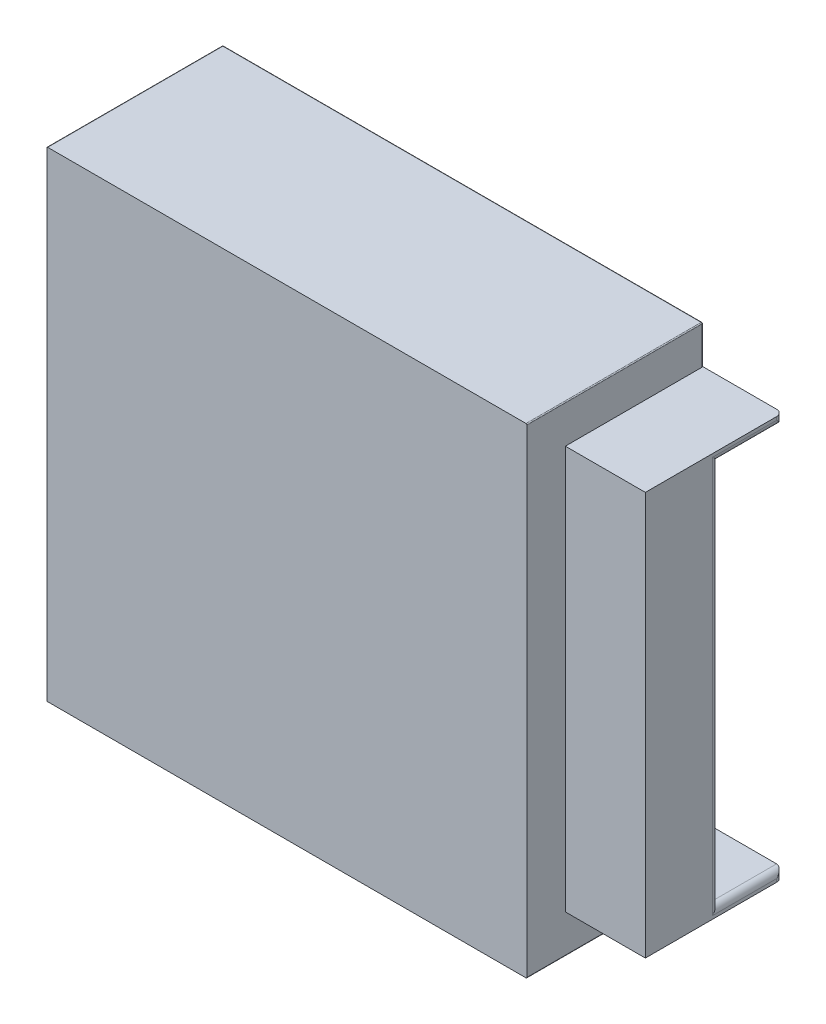
from build123d import *

# Parameters (mm, degrees)
SKETCH_1_W           = 150
SKETCH_1_H           = 150
EXTRUDE_2_DEPTH      = 55
CUT_EXTRUDE_1_DEPTH  = 52
SKETCH_3_W           = 20
SKETCH_3_H           = 25.2
CUT_EXTRUDE_2_DEPTH  = 52
SKETCH_4_W           = 31.2
SKETCH_4_H           = 23.663491794
CUT_EXTRUDE_3_DEPTH  = 52
SKETCH_5_W           = 46
SKETCH_5_H           = 120
SKETCH_5_W_2         = 29
CUT_EXTRUDE_4_DEPTH  = 40
SKETCH_6_W           = 3
SKETCH_6_H           = 120
EXTRUDE_4_DEPTH      = 25
SKETCH_7_W           = 3
SKETCH_7_H           = 120
EXTRUDE_5_DEPTH      = 20
CUT_EXTRUDE_6_DEPTH  = 30
FILLET_1_R           = 7
SKETCH_10_W          = 80
SKETCH_10_H          = 50
CUT_EXTRUDE_7_DEPTH  = 30
SKETCH_11_W          = 11.4
SKETCH_11_H          = 20
CUT_EXTRUDE_8_DEPTH  = 30
FILLET_2_R           = 5
FILLET_3_R           = 2
SKETCH_12_W          = 12.6
SKETCH_12_H          = 20
CUT_EXTRUDE_9_DEPTH  = 20
FILLET_4_R           = 2
SKETCH_13_R          = 0.75
CUT_EXTRUDE_10_DEPTH = 5
FILLET_5_R           = 2
FILLET_6_R           = 1
FILLET_8_R           = 0.3


with BuildPart() as part:
    # 草图1 → 凸台-拉伸2 (new body)
    with BuildSketch(Plane.XY):
        with Locations((75, -75)):
            Rectangle(SKETCH_1_W, SKETCH_1_H)
    extrude(amount=EXTRUDE_2_DEPTH)

    # 草图2 → 切除-拉伸1 (cut)
    with BuildSketch(Plane(origin=(0, 0, 0), x_dir=(-1, 0, 0), z_dir=(0, 0, -1))):
        Polygon((-57.4, -53), (-92.6, -53), (-97, -57.4), (-97, -92.6), (-92.6, -97), (-57.4, -97), (-53, -92.6), (-53, -57.4), align=None)
    extrude(amount=-CUT_EXTRUDE_1_DEPTH, mode=Mode.SUBTRACT)

    # 草图3 → 切除-拉伸2 (cut)
    with BuildSketch(Plane(origin=(0, 0, 0), x_dir=(-1, 0, 0), z_dir=(0, 0, -1))):
        with Locations((-43, -75)):
            Rectangle(SKETCH_3_W, SKETCH_3_H)
    extrude(amount=-CUT_EXTRUDE_2_DEPTH, mode=Mode.SUBTRACT)

    # 草图4 → 切除-拉伸3 (cut)
    with BuildSketch(Plane(origin=(0, 0, 0), x_dir=(-1, 0, 0), z_dir=(0, 0, -1))):
        with Locations((-75, -41.168254103)):
            Rectangle(SKETCH_4_W, SKETCH_4_H)
    extrude(amount=-CUT_EXTRUDE_3_DEPTH, mode=Mode.SUBTRACT)

    # 草图5 → 切除-拉伸4 (cut)
    with BuildSketch(Plane(origin=(0, 0, 0), x_dir=(-1, 0, 0), z_dir=(0, 0, -1))):
        with Locations((-127, -75)):
            Rectangle(SKETCH_5_W, SKETCH_5_H)
        with Locations((-164.5, -75)):
            Rectangle(SKETCH_5_W_2, SKETCH_5_H)
    extrude(amount=-CUT_EXTRUDE_4_DEPTH, mode=Mode.SUBTRACT)

    # 草图6 → 凸台-拉伸4 (add)
    with BuildSketch(Plane(origin=(150, 0, 0), x_dir=(0, 0, -1), z_dir=(1, 0, 0))):
        Polygon((-43, -15), (-40, -15), (0, -15), (0, -12), (-43, -12), align=None)
        with Locations((-41.5, -75)):
            Rectangle(SKETCH_6_W, SKETCH_6_H)
        Polygon((0, -135), (-40, -135), (-43, -135), (-43, -138), (0, -138), align=None)
    extrude(amount=EXTRUDE_4_DEPTH)

    # 草图7 → 凸台-拉伸5 (add)
    with BuildSketch(Plane(origin=(0, 0, 40), x_dir=(-1, 0, 0), z_dir=(0, 0, -1))):
        with Locations((-173.5, -75)):
            Rectangle(SKETCH_7_W, SKETCH_7_H)
    extrude(amount=EXTRUDE_5_DEPTH)

    # 草图8 → 切除-拉伸6 (cut)
    with BuildSketch(Plane(origin=(0, 0, 0), x_dir=(-1, 0, 0), z_dir=(0, 0, -1))):
        Polygon((-69, -15), (-104, -15), (-104, -29.336508206), (-90.6, -29.336508206), (-69, -29.336508206), align=None)
    extrude(amount=-CUT_EXTRUDE_6_DEPTH, mode=Mode.SUBTRACT)

    # 圆角1
    fillet_1_edges = [part.edges().sort_by_distance(p)[0] for p in [
        (104, -22.168254103, 30),
        (79.8, -29.336508206, 30),
    ]]
    fillet(fillet_1_edges, radius=FILLET_1_R)

    # 草图10 → 切除-拉伸7 (cut)
    with BuildSketch(Plane(origin=(0, 0, 0), x_dir=(-1, 0, 0), z_dir=(0, 0, -1))):
        with Locations((-52.6, -123.5)):
            Rectangle(SKETCH_10_W, SKETCH_10_H)
    extrude(amount=-CUT_EXTRUDE_7_DEPTH, mode=Mode.SUBTRACT)

    # 草图11 → 切除-拉伸8 (cut)
    with BuildSketch(Plane(origin=(0, 0, 0), x_dir=(-1, 0, 0), z_dir=(0, 0, -1))):
        with Locations((-98.3, -115)):
            Rectangle(SKETCH_11_W, SKETCH_11_H)
    extrude(amount=-CUT_EXTRUDE_8_DEPTH, mode=Mode.SUBTRACT)

    # 圆角2
    fillet_2_edges = [part.edges().sort_by_distance(p)[0] for p in [
        (104, -115, 30),
    ]]
    fillet(fillet_2_edges, radius=FILLET_2_R)

    # 圆角3
    fillet_3_edges = [part.edges().sort_by_distance(p)[0] for p in [
        (90.6, -29.336508206, 15),
        (69, -29.336508206, 18.5),
        (104, -29.336508206, 18.5),
        (104, -125, 17.5),
        (104, -105, 17.5),
        (92.6, -105, 15),
        (92.6, -125, 15),
    ]]
    fillet(fillet_3_edges, radius=FILLET_3_R)

    # 草图12 → 切除-拉伸9 (cut)
    with BuildSketch(Plane(origin=(0, 0, 0), x_dir=(-1, 0, 0), z_dir=(0, 0, -1))):
        with Locations((-6.3, -125)):
            Rectangle(SKETCH_12_W, SKETCH_12_H)
    extrude(amount=-CUT_EXTRUDE_9_DEPTH, mode=Mode.SUBTRACT)

    # 圆角4
    fillet_4_edges = [part.edges().sort_by_distance(p)[0] for p in [
        (12.6, -125, 20),
        (12.6, -135, 10),
        (12.6, -115, 10),
        (0, -125, 20),
        (0, -115, 10),
        (0, -135, 10),
    ]]
    fillet(fillet_4_edges, radius=FILLET_4_R)

    # 草图13 → 切除-拉伸10 (cut)
    with BuildSketch(Plane(origin=(0, 0, 0), x_dir=(-1, 0, 0), z_dir=(0, 0, -1))):
        with Locations((-97, -53)):
            Circle(SKETCH_13_R)
        with Locations(Location((-97, -97, 0), (0, 0, 180))):
            Circle(SKETCH_13_R)
        with Locations((-53, -97)):
            Circle(SKETCH_13_R)
        with Locations(Location((-53, -53, 0), (0, 0, 180))):
            Circle(SKETCH_13_R)
    extrude(amount=-CUT_EXTRUDE_10_DEPTH, mode=Mode.SUBTRACT)

    # 圆角5
    fillet_5_edges = [part.edges().sort_by_distance(p)[0] for p in [
        (175, -13.5, 0),
        (175, -75, 20),
        (175, -15, 10),
        (175, -136.5, 0),
        (175, -135, 10),
    ]]
    fillet(fillet_5_edges, radius=FILLET_5_R)

    # 圆角6
    fillet_6_edges = [part.edges().sort_by_distance(p)[0] for p in [
        (52.6, -148.5, 0),
    ]]
    fillet(fillet_6_edges, radius=FILLET_6_R)

    # 圆角8
    fillet_8_edges = [part.edges().sort_by_distance(p)[0] for p in [
        (12.6, -105.75, 0),
        (0, -143.5, 0),
        (6.3, -135, 0),
        (12.6, -143.25, 0),
        (12.014213562, -135.585786438, 0),
        (0.585786438, -135.585786438, 0),
        (6.3, -115, 0),
        (0.585786438, -114.414213562, 0),
        (12.014213562, -114.414213562, 0),
        (75, 0, 0),
        (150, -144, 0),
        (75, -150, 0),
        (0, -56.5, 0),
        (0, 0, 27.5),
        (150, 0, 27.5),
        (150, -150, 27.5),
        (0, -150, 27.5),
        (150, -6, 0),
    ]]
    fillet(fillet_8_edges, radius=FILLET_8_R)


solid = part.part
